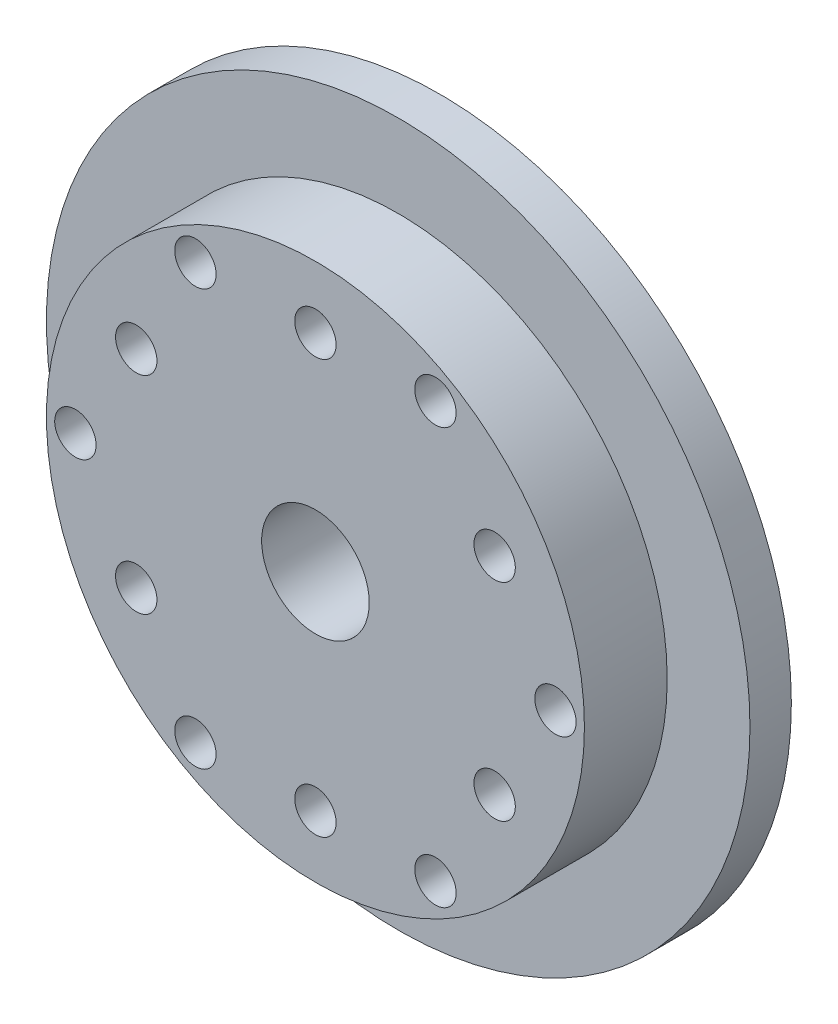
from build123d import *

# Parameters (mm, degrees)
SKETCH1_R           = 42.5
SKETCH1_R_2         = 12
BOSS_EXTRUDE1_DEPTH = 5
SKETCH2_R           = 32.5
SKETCH2_R_2         = 6.5
BOSS_EXTRUDE2_DEPTH = 10
SKETCH3_R           = 4
BOSS_EXTRUDE3_DEPTH = 10
SKETCH5_R           = 2.5
CUT_EXTRUDE1_DEPTH  = 10
SKETCH7_R           = 2.5
CUT_EXTRUDE2_DEPTH  = 10


with BuildPart() as part:
    # Sketch1 → Boss-Extrude1 (new body)
    with BuildSketch(Plane.XY):
        Circle(SKETCH1_R)
        Circle(SKETCH1_R_2, mode=Mode.SUBTRACT)
    extrude(amount=BOSS_EXTRUDE1_DEPTH)

    # Sketch2 → Boss-Extrude2 (add)
    with BuildSketch(Plane.XY.offset(5)):
        Circle(SKETCH2_R)
        Circle(SKETCH2_R_2, mode=Mode.SUBTRACT)
    extrude(amount=BOSS_EXTRUDE2_DEPTH)

    # Sketch3 → Boss-Extrude3 (add)
    with BuildSketch(Plane(origin=(0, 0, 0), x_dir=(-1, 0, 0), z_dir=(0, 0, -1))):
        with Locations(Location((0, 22.5, 0), (0, 0, 180))):
            Circle(SKETCH3_R)
        with Locations(Location((15.909902577, 15.909902577, 0), (0, 0, 180))):
            Circle(SKETCH3_R)
        with Locations(Location((22.5, 0, 0), (0, 0, 180))):
            Circle(SKETCH3_R)
        with Locations(Location((15.909902577, -15.909902577, 0), (0, 0, 180))):
            Circle(SKETCH3_R)
        with Locations(Location((0, -22.5, 0), (0, 0, 180))):
            Circle(SKETCH3_R)
        with Locations(Location((-15.909902577, -15.909902577, 0), (0, 0, 180))):
            Circle(SKETCH3_R)
        with Locations(Location((-22.5, 0, 0), (0, 0, 180))):
            Circle(SKETCH3_R)
        with Locations(Location((-15.909902577, 15.909902577, 0), (0, 0, 180))):
            Circle(SKETCH3_R)
    extrude(amount=BOSS_EXTRUDE3_DEPTH)

    # Sketch5 → Cut-Extrude1 (cut)
    with BuildSketch(Plane.XY.offset(15)):
        with Locations((0, 25)):
            Circle(SKETCH5_R)
        with Locations((21.650635095, 12.5)):
            Circle(SKETCH5_R)
        with Locations((21.650635095, -12.5)):
            Circle(SKETCH5_R)
        with Locations((0, -25)):
            Circle(SKETCH5_R)
        with Locations((-21.650635095, -12.5)):
            Circle(SKETCH5_R)
        with Locations((-21.650635095, 12.5)):
            Circle(SKETCH5_R)
    extrude(amount=-CUT_EXTRUDE1_DEPTH, mode=Mode.SUBTRACT)

    # Sketch7 → Cut-Extrude2 (cut)
    with BuildSketch(Plane.XY.offset(15)):
        with Locations((29, 0)):
            Circle(SKETCH7_R)
        with Locations((14.5, -25.11473671)):
            Circle(SKETCH7_R)
        with Locations((-14.5, -25.11473671)):
            Circle(SKETCH7_R)
        with Locations((-29, 0)):
            Circle(SKETCH7_R)
        with Locations((-14.5, 25.11473671)):
            Circle(SKETCH7_R)
        with Locations((14.5, 25.11473671)):
            Circle(SKETCH7_R)
    extrude(amount=-CUT_EXTRUDE2_DEPTH, mode=Mode.SUBTRACT)


solid = part.part
